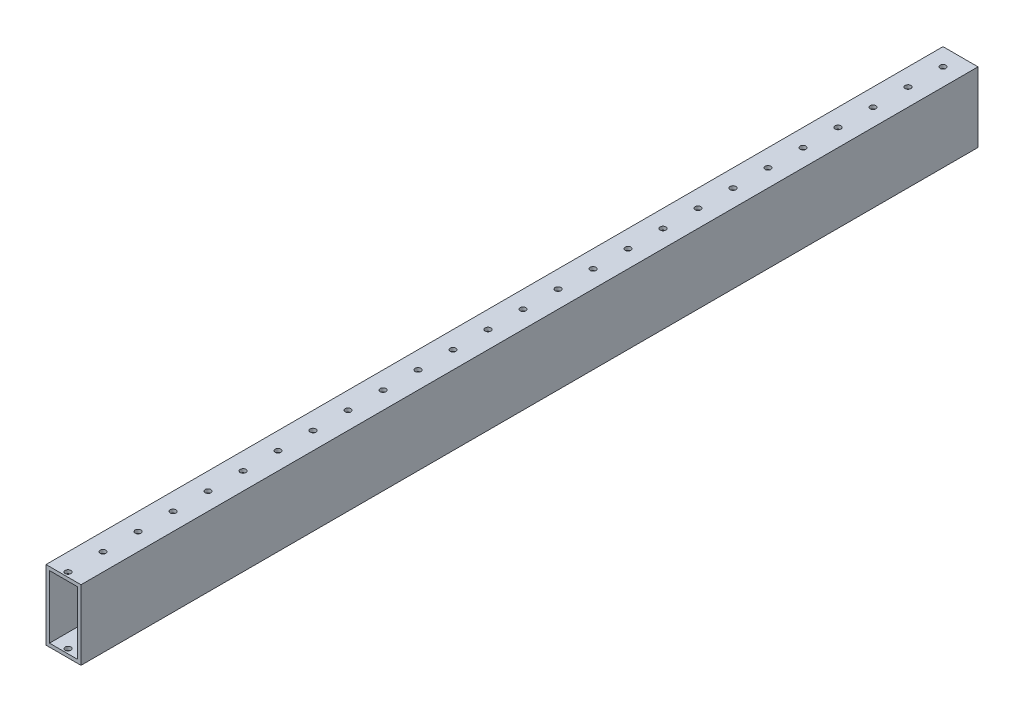
from build123d import *

# Parameters (mm, degrees)
CROQUIS1_W              = 25.4
CROQUIS1_H              = 50.7
CROQUIS1_W_2            = 20.32
CROQUIS1_H_2            = 45.62
SALIENTE_EXTRUIR1_DEPTH = 651
CROQUIS2_R              = 2.07
CORTAR_EXTRUIR2_DEPTH   = 54


with BuildPart() as part:
    # Croquis1 → Saliente-Extruir1 (new body)
    with BuildSketch(Plane.XY):
        Rectangle(CROQUIS1_W, CROQUIS1_H)
        Rectangle(CROQUIS1_W_2, CROQUIS1_H_2, mode=Mode.SUBTRACT)
    extrude(amount=SALIENTE_EXTRUIR1_DEPTH)

    # Croquis2 → Cortar-Extruir2 (cut)
    with BuildSketch(Plane(origin=(0, 25.35, 0), x_dir=(1, 0, 0), z_dir=(0, 1, 0))):
        with Locations(Location((0, -12.7, 0), (0, 0, 270))):
            Circle(CROQUIS2_R)
        with Locations(Location((0, -38.1, 0), (0, 0, 270))):
            Circle(CROQUIS2_R)
        with Locations(Location((0, -63.5, 0), (0, 0, 270))):
            Circle(CROQUIS2_R)
        with Locations(Location((0, -88.9, 0), (0, 0, 270))):
            Circle(CROQUIS2_R)
        with Locations(Location((0, -114.3, 0), (0, 0, 270))):
            Circle(CROQUIS2_R)
        with Locations(Location((0, -139.7, 0), (0, 0, 270))):
            Circle(CROQUIS2_R)
        with Locations(Location((0, -165.1, 0), (0, 0, 270))):
            Circle(CROQUIS2_R)
        with Locations(Location((0, -190.5, 0), (0, 0, 270))):
            Circle(CROQUIS2_R)
        with Locations(Location((0, -215.9, 0), (0, 0, 270))):
            Circle(CROQUIS2_R)
        with Locations(Location((0, -241.3, 0), (0, 0, 270))):
            Circle(CROQUIS2_R)
        with Locations(Location((0, -266.7, 0), (0, 0, 270))):
            Circle(CROQUIS2_R)
        with Locations(Location((0, -292.1, 0), (0, 0, 270))):
            Circle(CROQUIS2_R)
        with Locations(Location((0, -317.5, 0), (0, 0, 270))):
            Circle(CROQUIS2_R)
        with Locations(Location((0, -342.9, 0), (0, 0, 270))):
            Circle(CROQUIS2_R)
        with Locations(Location((0, -368.3, 0), (0, 0, 270))):
            Circle(CROQUIS2_R)
        with Locations(Location((0, -393.7, 0), (0, 0, 270))):
            Circle(CROQUIS2_R)
        with Locations(Location((0, -419.1, 0), (0, 0, 270))):
            Circle(CROQUIS2_R)
        with Locations(Location((0, -444.5, 0), (0, 0, 270))):
            Circle(CROQUIS2_R)
        with Locations(Location((0, -469.9, 0), (0, 0, 270))):
            Circle(CROQUIS2_R)
        with Locations(Location((0, -495.3, 0), (0, 0, 270))):
            Circle(CROQUIS2_R)
        with Locations(Location((0, -520.7, 0), (0, 0, 270))):
            Circle(CROQUIS2_R)
        with Locations(Location((0, -546.1, 0), (0, 0, 270))):
            Circle(CROQUIS2_R)
        with Locations(Location((0, -571.5, 0), (0, 0, 270))):
            Circle(CROQUIS2_R)
        with Locations(Location((0, -596.9, 0), (0, 0, 270))):
            Circle(CROQUIS2_R)
        with Locations(Location((0, -622.3, 0), (0, 0, 270))):
            Circle(CROQUIS2_R)
        with Locations(Location((0, -647.7, 0), (0, 0, 270))):
            Circle(CROQUIS2_R)
    extrude(amount=-CORTAR_EXTRUIR2_DEPTH, mode=Mode.SUBTRACT)


solid = part.part
